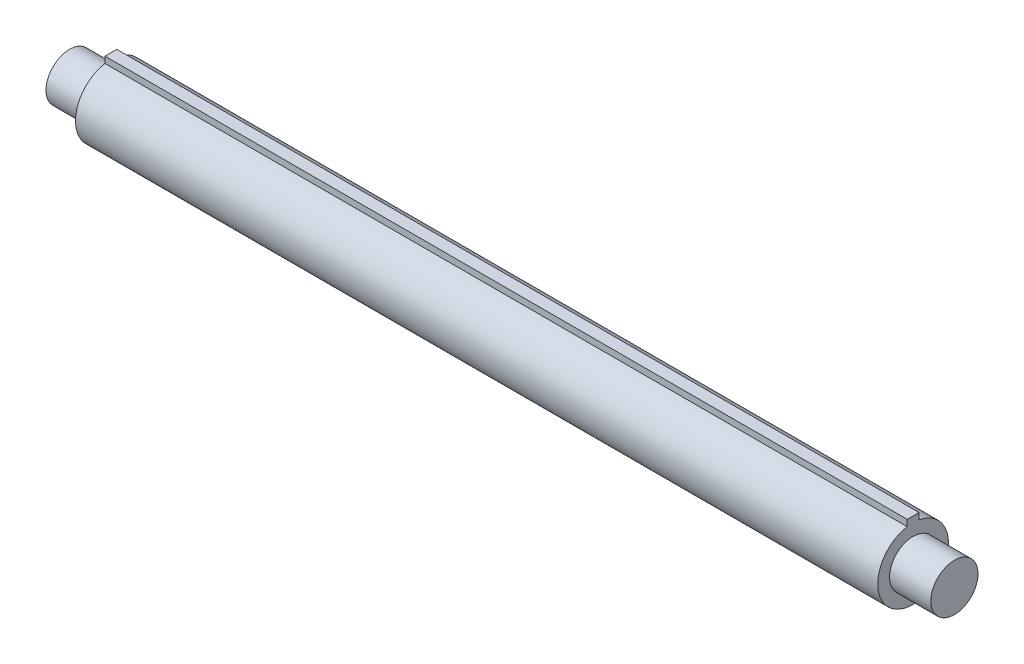
from build123d import *

# Parameters (mm, degrees)
SKETCH2_W           = 1
SKETCH2_H           = 1
BOSS_EXTRUDE1_DEPTH = 68


with BuildPart() as part:
    # Sketch1 → Revolve1 (revolve)
    with BuildSketch(Plane.XY):
        Polygon((0, 0), (-75, 0), (-75, 2), (-71.5, 2), (-71.5, 3), (-3.5, 3), (-3.5, 2), (0, 2), align=None)
    revolve(axis=Axis((0, 0, 0), (-1, 0, 0)))

    # Sketch2 → Boss-Extrude1 (add)
    with BuildSketch(Plane.ZY.offset(71.5)):
        with Locations((0, 3)):
            Rectangle(SKETCH2_W, SKETCH2_H)
    extrude(amount=-BOSS_EXTRUDE1_DEPTH)


solid = part.part
